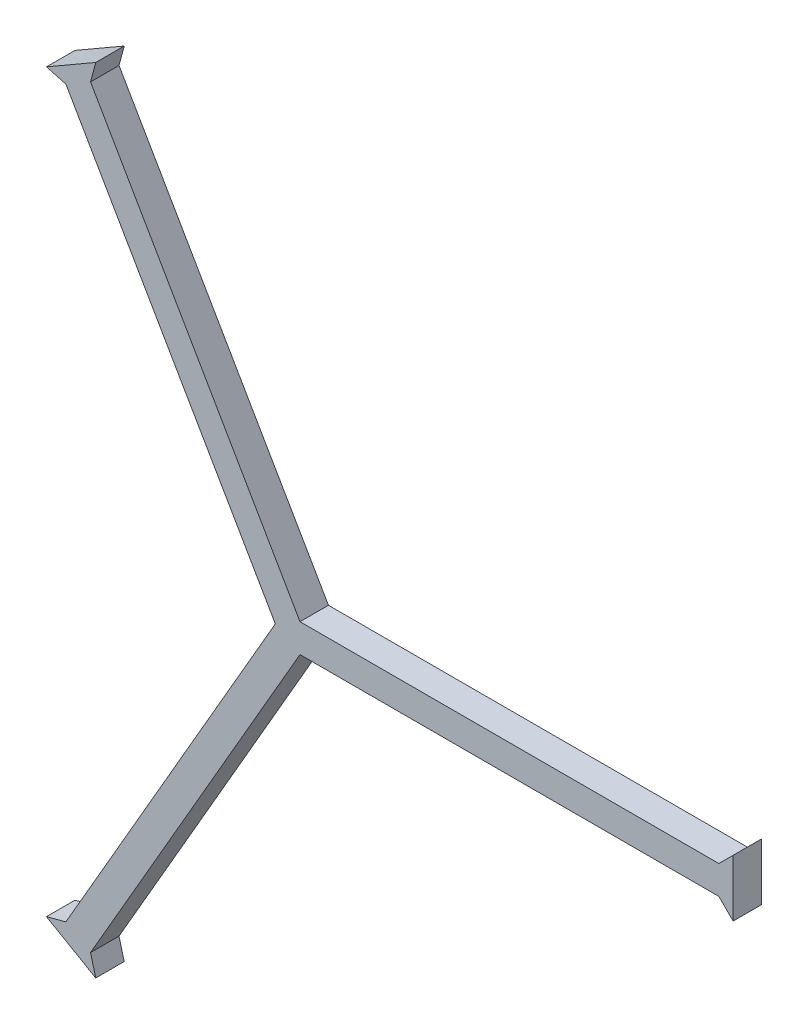
from build123d import *

# Parameters (mm, degrees)
BOSS_EXTRUDE1_DEPTH = 10
CIRPATTERN1_COUNT   = 3


with BuildPart() as part:
    # Sketch1 → Boss-Extrude1 (new body)
    with BuildSketch(Plane.XY):
        Polygon((155, 10), (150, 5), (0, 5), (0, -5), (150, -5), (155, -10), align=None)
    boss_extrude1 = extrude(amount=BOSS_EXTRUDE1_DEPTH)

    # CirPattern1: Boss-Extrude1 ×3 about axis
    cirpattern1_axis = Axis((0, 0, 0), (0, 0, 1))
    for i in range(1, CIRPATTERN1_COUNT):
        add(boss_extrude1.rotate(cirpattern1_axis, i * 360 / CIRPATTERN1_COUNT))


solid = part.part
